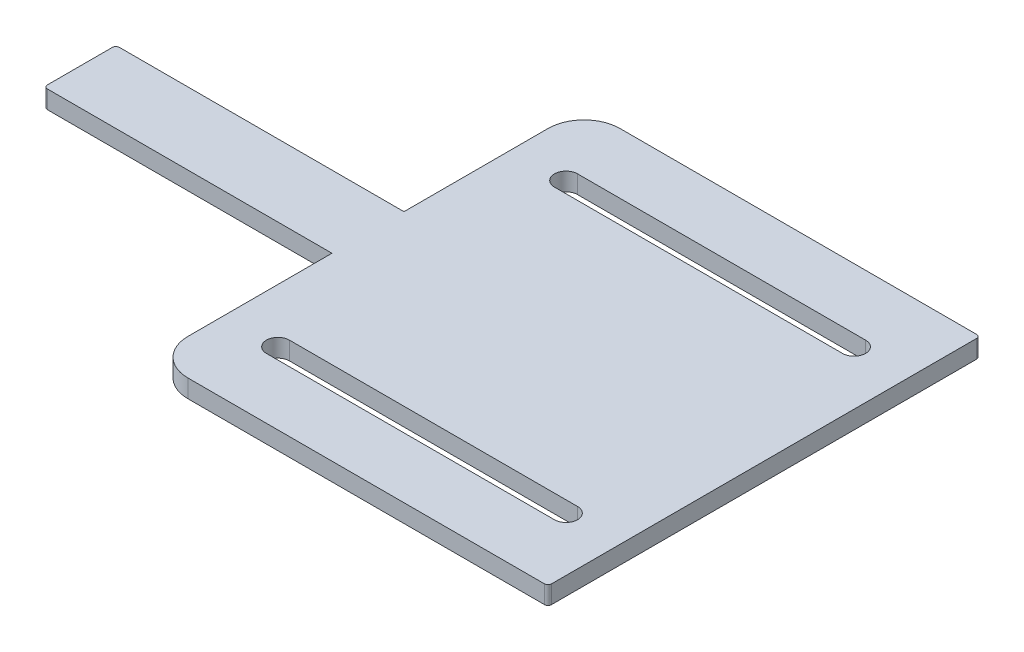
from build123d import *

# Parameters (mm, degrees)
SKETCH1_W           = 139.7
SKETCH1_H           = 152.4
BOSS_EXTRUDE1_DEPTH = 6.35
FILLET1_R           = 12.7
SKETCH2_W           = 101.6
SKETCH2_H           = 25.4
BOSS_EXTRUDE2_DEPTH = 6.35
FILLET2_R           = 1.27


with BuildPart() as part:
    # Sketch1 → Boss-Extrude1 (new body)
    with BuildSketch(Plane(origin=(0, 0, 0), x_dir=(1, 0, 0), z_dir=(0, 1, 0))):
        Rectangle(SKETCH1_W, SKETCH1_H)
        with BuildLine():
            ThreePointArc((54.864, -50.8), (53.673681959, -53.673681959), (50.8, -54.864))
            Line((50.8, -54.864), (-50.8, -54.864))
            ThreePointArc((-50.8, -54.864), (-54.864, -50.8), (-50.8, -46.736))
            Line((-50.8, -46.736), (50.8, -46.736))
            ThreePointArc((50.8, -46.736), (53.673681959, -47.926318041), (54.864, -50.8))
        make_face(mode=Mode.SUBTRACT)
        with BuildLine():
            ThreePointArc((-50.8, 46.736), (-54.864, 50.8), (-50.8, 54.864))
            Line((-50.8, 54.864), (50.8, 54.864))
            ThreePointArc((50.8, 54.864), (53.673681959, 53.673681959), (54.864, 50.8))
            ThreePointArc((54.864, 50.8), (53.673681959, 47.926318041), (50.8, 46.736))
            Line((50.8, 46.736), (-50.8, 46.736))
        make_face(mode=Mode.SUBTRACT)
    extrude(amount=BOSS_EXTRUDE1_DEPTH)

    # Fillet1
    fillet1_edges = [part.edges().sort_by_distance(p)[0] for p in [
        (-69.85, 3.175, 76.2),
        (-69.85, 3.175, -76.2),
    ]]
    fillet(fillet1_edges, radius=FILLET1_R)

    # Sketch2 → Boss-Extrude2 (add)
    with BuildSketch(Plane(origin=(0, 6.35, 0), x_dir=(1, 0, 0), z_dir=(0, 1, 0))):
        with Locations((-120.65, 0)):
            Rectangle(SKETCH2_W, SKETCH2_H)
    extrude(amount=-BOSS_EXTRUDE2_DEPTH)

    # Fillet2
    fillet2_edges = [part.edges().sort_by_distance(p)[0] for p in [
        (69.85, 3.175, -76.2),
        (69.85, 3.175, 76.2),
        (-171.45, 3.175, 12.7),
        (-171.45, 3.175, -12.7),
    ]]
    fillet(fillet2_edges, radius=FILLET2_R)


solid = part.part
